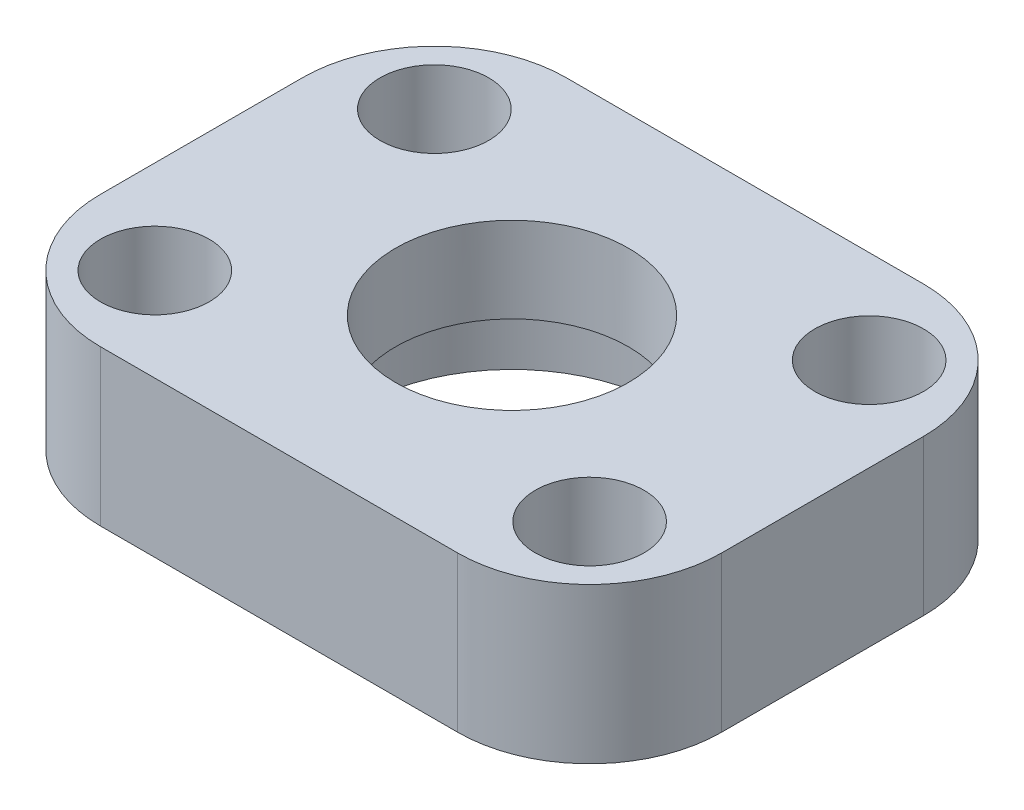
from build123d import *

# Parameters (mm, degrees)
SKETCH1_W             = 40
SKETCH1_H             = 30
BOSS_EXTRUDE1_DEPTH   = 10
SKETCH3_R             = 9.875
CUT_EXTRUDE1_DEPTH    = 4.5
SKETCH4_R             = 7.5
CUT_EXTRUDE2_DEPTH    = 27.925824036
F_3_0MM_DOWEL_HOLE1_D = 3
FILLET1_R             = 8.5
SKETCH9_R             = 3.5
CUT_EXTRUDE3_DEPTH    = 5


with BuildPart() as part:
    # Sketch1 → Boss-Extrude1 (new body)
    with BuildSketch(Plane(origin=(0, 0, 0), x_dir=(1, 0, 0), z_dir=(0, 1, 0))):
        Rectangle(SKETCH1_W, SKETCH1_H)
    extrude(amount=BOSS_EXTRUDE1_DEPTH)

    # Sketch3 → Cut-Extrude1 (cut)
    with BuildSketch(Plane.XZ):
        with Locations(Location((0, 0, 0), (0, 0, 270))):
            Circle(SKETCH3_R)
    extrude(amount=-CUT_EXTRUDE1_DEPTH, mode=Mode.SUBTRACT)

    # Sketch4 → Cut-Extrude2 (cut, through all)
    with BuildSketch(Plane(origin=(0, 10, 0), x_dir=(1, 0, 0), z_dir=(0, 1, 0))):
        with Locations(Location((0, 0, 0), (0, 0, 270))):
            Circle(SKETCH4_R)
    extrude(amount=-CUT_EXTRUDE2_DEPTH, mode=Mode.SUBTRACT)

    # Ø3.0mm Dowel Hole1 (through all)
    with Locations(Plane(origin=(0, 10, 0), x_dir=(1, 0, 0), z_dir=(0, 1, 0))):
        with Locations((-14, 9), (-14, -9), (14, -9), (14, 9)):
            Hole(F_3_0MM_DOWEL_HOLE1_D / 2)

    # Fillet1
    fillet1_edges = [part.edges().sort_by_distance(p)[0] for p in [
        (20, 5, 15),
        (-20, 5, 15),
        (-20, 5, -15),
        (20, 5, -15),
    ]]
    fillet(fillet1_edges, radius=FILLET1_R)

    # Sketch9 → Cut-Extrude3 (cut)
    with BuildSketch(Plane(origin=(0, 10, 0), x_dir=(1, 0, 0), z_dir=(0, 1, 0))):
        with Locations(Location((14, -9, 0), (0, 0, 270))):
            Circle(SKETCH9_R)
        with Locations(Location((-14, -9, 0), (0, 0, 270))):
            Circle(SKETCH9_R)
        with Locations(Location((-14, 9, 0), (0, 0, 270))):
            Circle(SKETCH9_R)
        with Locations(Location((14, 9, 0), (0, 0, 270))):
            Circle(SKETCH9_R)
    extrude(amount=-CUT_EXTRUDE3_DEPTH, mode=Mode.SUBTRACT)


solid = part.part
